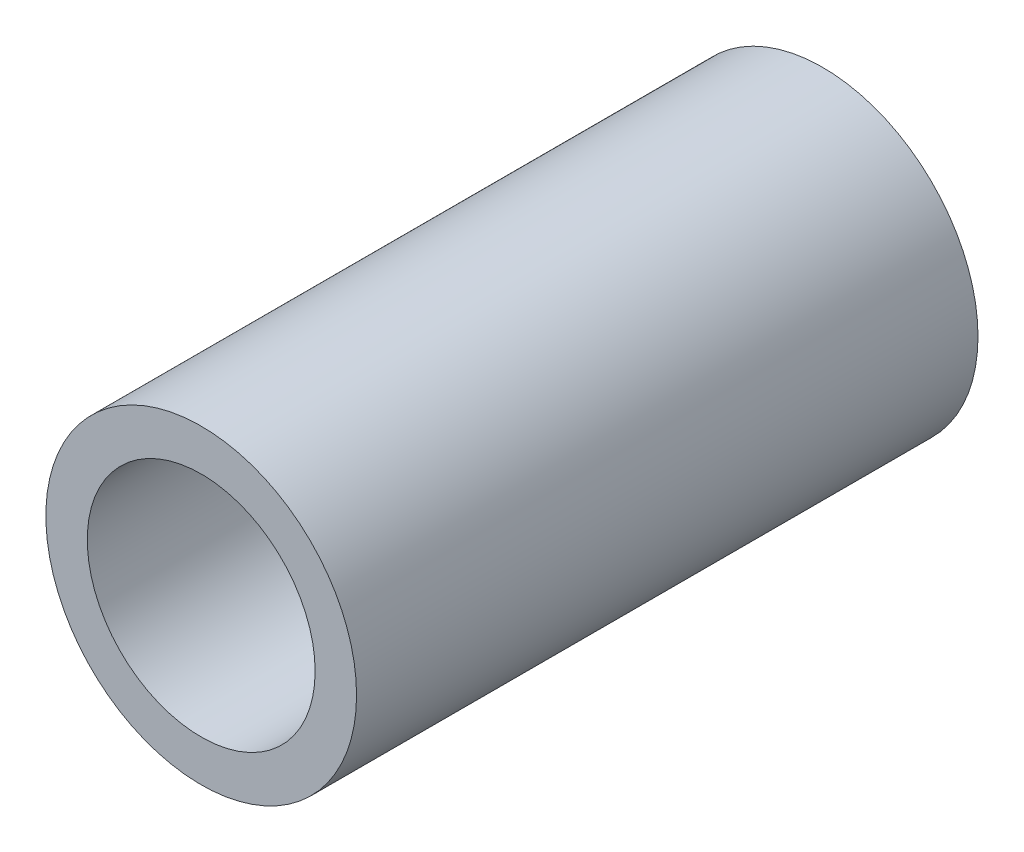
from build123d import *

# Parameters (mm, degrees)
SKETCH1_R           = 30
BOSS_EXTRUDE1_DEPTH = 120
SKETCH2_R           = 22
CUT_EXTRUDE1_DEPTH  = 140


with BuildPart() as part:
    # Sketch1 → Boss-Extrude1 (new body)
    with BuildSketch(Plane.XY):
        Circle(SKETCH1_R)
    extrude(amount=BOSS_EXTRUDE1_DEPTH)

    # Sketch2 → Cut-Extrude1 (cut)
    with BuildSketch(Plane.XY.offset(120)):
        Circle(SKETCH2_R)
    extrude(amount=-CUT_EXTRUDE1_DEPTH, mode=Mode.SUBTRACT)


solid = part.part
